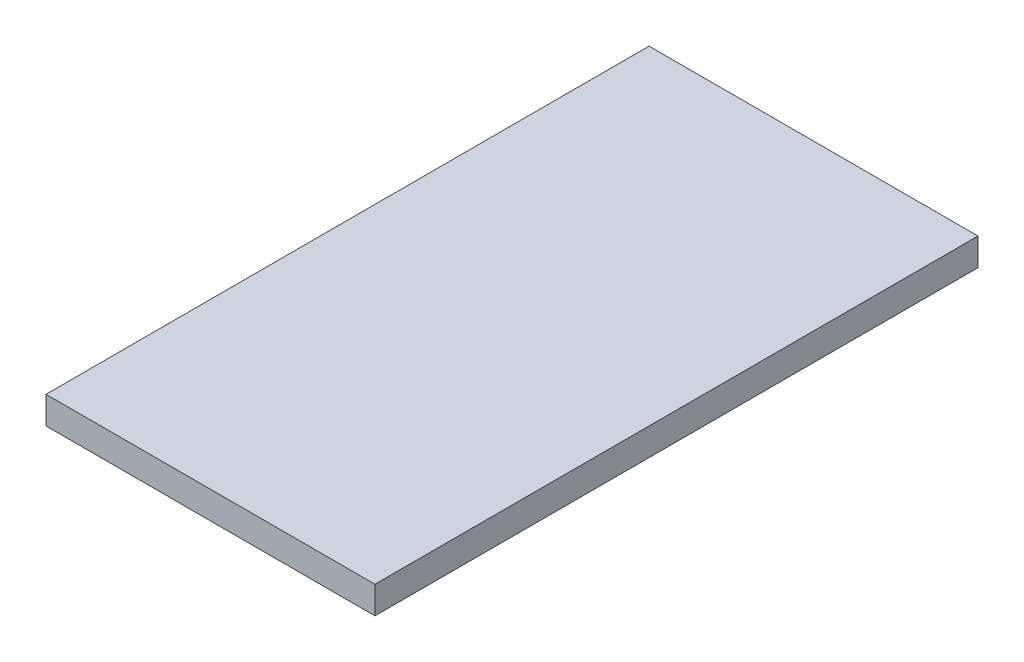
from build123d import *

# Parameters (mm, degrees)
SKETCH1_W           = 304.8
SKETCH1_H           = 304.8
BOSS_EXTRUDE1_DEPTH = 6.35
CUT_EXTRUDE2_DEPTH  = 6.35


with BuildPart() as part:
    # Sketch1 → Boss-Extrude1 (new body)
    with BuildSketch(Plane(origin=(0, 0, 0), x_dir=(1, 0, 0), z_dir=(0, 1, 0))):
        with Locations((152.4, 152.4)):
            Rectangle(SKETCH1_W, SKETCH1_H)
    extrude(amount=BOSS_EXTRUDE1_DEPTH)

    # Sketch2 → Cut-Extrude2 (cut)
    with BuildSketch(Plane(origin=(0, 6.35, 0), x_dir=(1, 0, 0), z_dir=(0, 1, 0))):
        Polygon((76.2, 304.8), (76.2, 165.1), (0, 165.1), (0, 0), (304.8, 0), (304.8, 304.8), align=None)
    extrude(amount=-CUT_EXTRUDE2_DEPTH, mode=Mode.SUBTRACT)


solid = part.part
